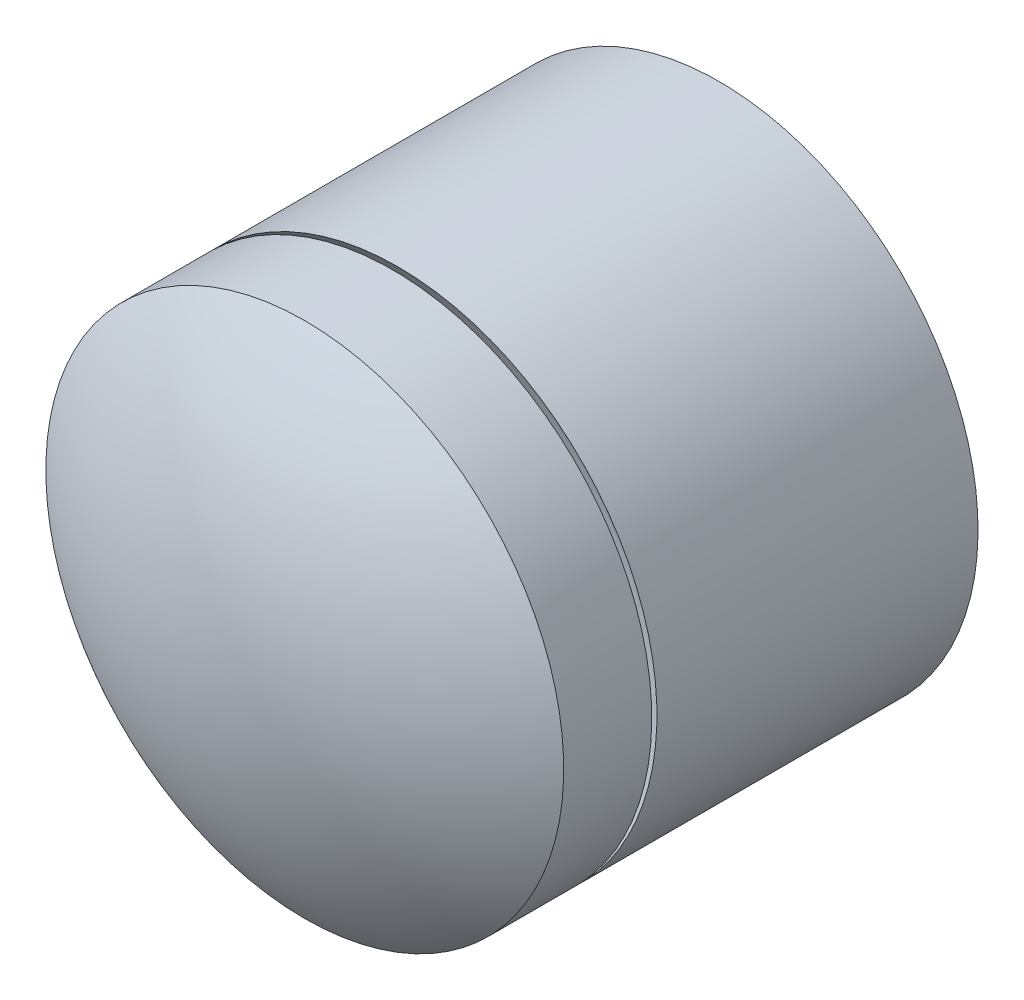
from build123d import *


with BuildPart() as part:
    # 草图1 → 旋转1 (revolve)
    with BuildSketch(Plane(origin=(0, 0, 0), x_dir=(0, 0, -1), z_dir=(1, 0, 0)), mode=Mode.PRIVATE) as revolve_1_sk:
        with BuildLine():
            Line((0.930037038, 1), (-0.310037038, 1))
            ThreePointArc((-0.310037038, 1), (-0.064641455, 0.526527408), (0.02, 0))
            Line((0.02, 0), (0.99800863, 0))
            ThreePointArc((0.99800863, 0), (0.98099615, 0.501153703), (0.930037038, 1))
        make_face()
        with BuildLine():
            Line((-0.330037038, 1), (-0.669962962, 1))
            ThreePointArc((-0.669962962, 1), (-0.915358545, 0.526527408), (-1, 0))
            Line((-1, 0), (0, 0))
            ThreePointArc((0, 0), (-0.084641455, 0.526527408), (-0.330037038, 1))
        make_face()
    revolve(revolve_1_sk.sketch.rotate(Axis((0, 0, 1), (0, 0, -1)), 180), axis=Axis((0, 0, 1), (0, 0, -1)))


solid = part.part
